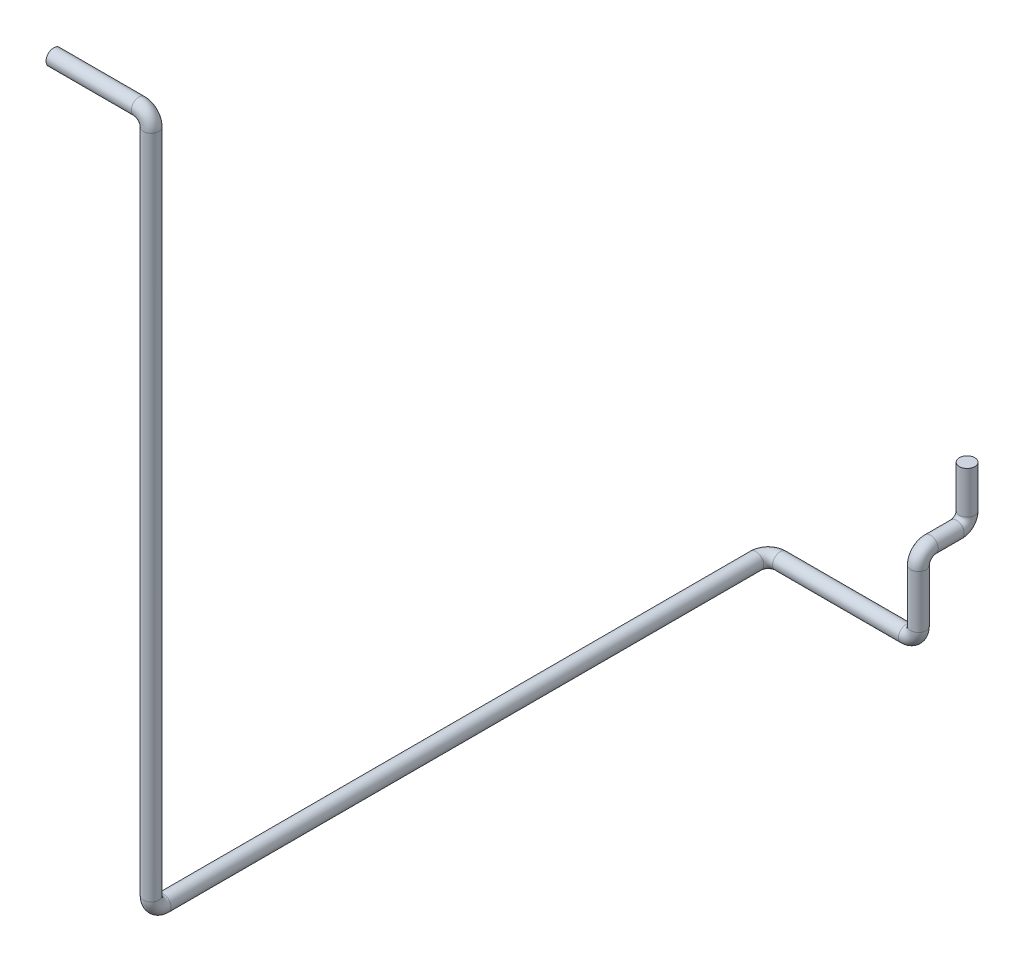
from build123d import *

# Parameters (mm, degrees)
CROQUIS1_R              = 9.525
SALIENTE_EXTRUIR1_DEPTH = 10
CROQUIS2_R              = 9.525


with BuildPart() as part:
    # Croquis1 → Saliente-Extruir1 (new body)
    with BuildSketch(Plane(origin=(0, 0, 0), x_dir=(1, 0, 0), z_dir=(0, 1, 0))):
        with Locations(Location((0, 0, 0), (0, 0, 270))):
            Circle(CROQUIS1_R)
    extrude(amount=-SALIENTE_EXTRUIR1_DEPTH)

    # Barrer1: sweep along a curve in space
    with BuildLine() as barrer1_path:
        Line((0, -10, 0), (0, -52, 0))
        ThreePointArc((0, -52, 0), (0, -61.192388155, 3.807611845), (0, -65, 13))
        Line((0, -65, 13), (0, -65, 45))
        ThreePointArc((0, -65, 45), (0, -69.393398282, 55.606601718), (0, -80, 60))
        Line((0, -80, 60), (0, -145, 60))
        ThreePointArc((0, -145, 60), (-4.393398282, -155.606601718, 60), (-15, -160, 60))
        Line((-15, -160, 60), (-170, -160, 60))
        ThreePointArc((-170, -160, 60), (-180.606601718, -160, 64.393398282), (-185, -160, 75))
        Line((-185, -160, 75), (-185, -160, 805))
        ThreePointArc((-185, -160, 805), (-185, -155.606601718, 815.606601718), (-185, -145, 820))
        Line((-185, -145, 820), (-185, 675, 820))
        ThreePointArc((-185, 675, 820), (-189.393398282, 685.606601718, 820), (-200, 690, 820))
        Line((-200, 690, 820), (-305, 690, 820))
    # Croquis2 → Barrer1 (sweep)
    with BuildSketch(Plane.XZ.offset(10)):
        Circle(CROQUIS2_R)
    sweep(path=barrer1_path.line)


solid = part.part
